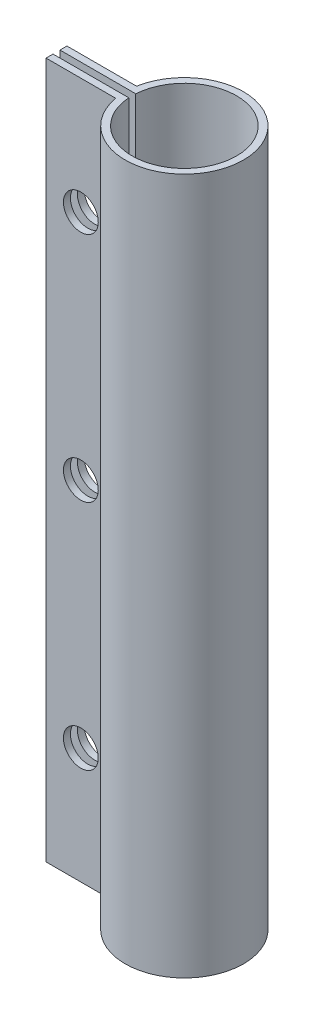
from build123d import *

# Parameters (mm, degrees)
AUFSATZ_LINEAR_AUSTRAGEN1_DEPTH = 50
SKIZZE2_R                       = 1.25
SCHNITT_LINEAR_AUSTRAGEN1_DEPTH = 52.081630762


with BuildPart() as part:
    # Skizze1 → Aufsatz-Linear austragen1 (new body)
    with BuildSketch(Plane(origin=(0, 0, 0), x_dir=(1, 0, 0), z_dir=(0, 1, 0))):
        with BuildLine():
            Line((-4.183300133, 0.25), (-3.741657387, 0.25))
            ThreePointArc((-3.741657387, 0.25), (3.75, 0), (-3.741657387, -0.25))
            Line((-3.741657387, -0.25), (-4.183300133, -0.25))
            Line((-4.183300133, -0.25), (-9.183300133, -0.25))
            Line((-9.183300133, -0.25), (-9.183300133, -0.75))
            Line((-9.183300133, -0.75), (-4.183300133, -0.75))
            ThreePointArc((-4.183300133, -0.75), (4.25, 0), (-4.183300133, 0.75))
            Line((-4.183300133, 0.75), (-9.183300133, 0.75))
            Line((-9.183300133, 0.75), (-9.183300133, 0.25))
            Line((-9.183300133, 0.25), (-4.183300133, 0.25))
        make_face()
    extrude(amount=AUFSATZ_LINEAR_AUSTRAGEN1_DEPTH)

    # Skizze2 → Schnitt-Linear austragen1 (cut, through all)
    with BuildSketch(Plane.XY.offset(0.75)):
        with Locations((-6.683300133, 41.666666667)):
            Circle(SKIZZE2_R)
        with Locations((-6.683300133, 25)):
            Circle(SKIZZE2_R)
        with Locations((-6.683300133, 8.333333333)):
            Circle(SKIZZE2_R)
    extrude(amount=-SCHNITT_LINEAR_AUSTRAGEN1_DEPTH, mode=Mode.SUBTRACT)


solid = part.part
